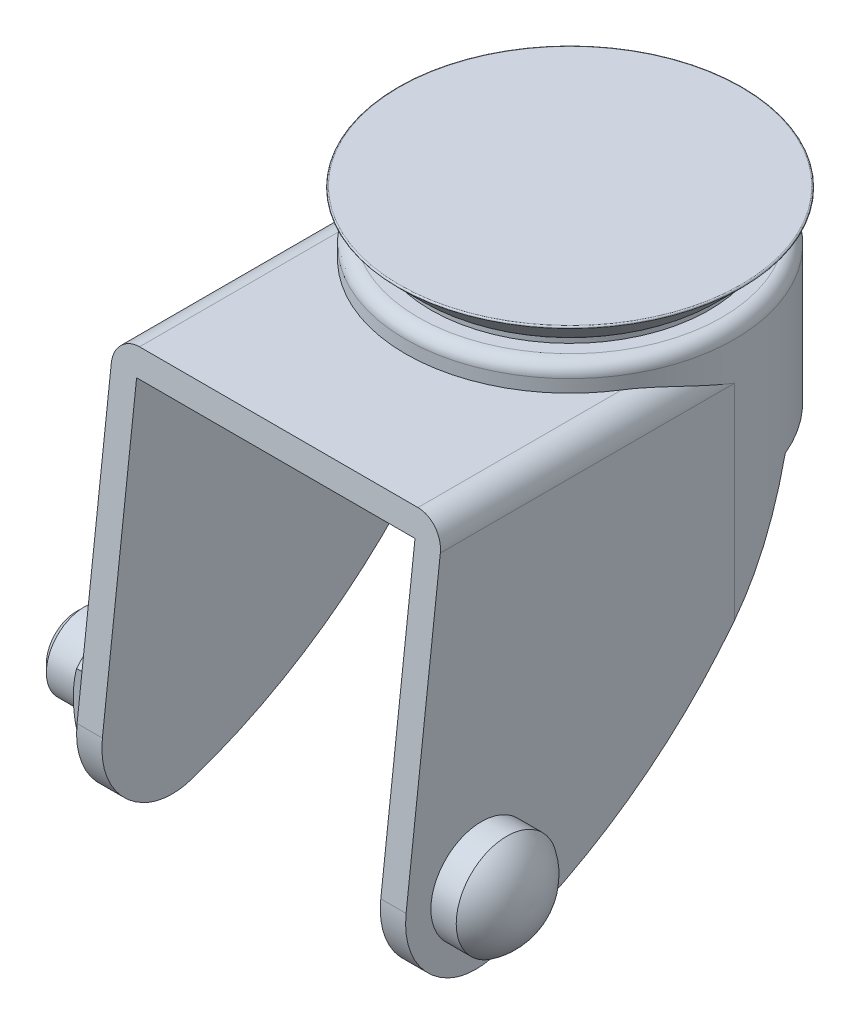
from build123d import *

# Parameters (mm, degrees)
BOSS_EXTRUDE1_DEPTH     = 60
SKETCH3_W               = 22
SKETCH3_H               = 51
CUT_EXTRUDE1_DEPTH      = 70
CUT_EXTRUDE2_START      = -51
SKETCH4_R               = 11
CUT_EXTRUDE2_DEPTH      = 51
CUT_EXTRUDE3_DEPTH      = 200
CUT_EXTRUDE3_DEPTH_BACK = 200
SKETCH8_R               = 5.3
CUT_EXTRUDE4_DEPTH      = 200


with BuildPart() as part:
    # Sketch1 → Revolve1 (revolve)
    with BuildSketch(Plane.XY, mode=Mode.PRIVATE) as revolve1_sk:
        with BuildLine():
            Line((0, 0), (11, 0))
            Line((11, 0), (11, -3))
            Line((11, -3), (12, -3))
            ThreePointArc((12, -3), (12.707106781, -3.292893219), (13, -4))
            Line((13, -4), (13, -51))
            Line((13, -51), (0, -51))
            Line((0, -51), (0, 0))
        make_face()
    revolve(revolve1_sk.sketch.rotate(Axis((0, -51, 0), (0, 1, 0)), 270), axis=Axis((0, -51, 0), (0, 1, 0)))

    # Sketch2 → Boss-Extrude1 (add)
    with BuildSketch(Plane.XY):
        with BuildLine():
            Line((-13, -56), (13, -56))
            Line((13, -56), (13, -7))
            ThreePointArc((13, -7), (12.414213562, -5.585786438), (11, -5))
            Line((11, -5), (-11, -5))
            ThreePointArc((-11, -5), (-12.414213562, -5.585786438), (-13, -7))
            Line((-13, -7), (-13, -56))
        make_face()
    extrude(amount=BOSS_EXTRUDE1_DEPTH)

    # Sketch3 → Cut-Extrude1 (cut)
    with BuildSketch(Plane.XY):
        with Locations((0, -32.5)):
            Rectangle(SKETCH3_W, SKETCH3_H)
    extrude(amount=CUT_EXTRUDE1_DEPTH, mode=Mode.SUBTRACT)

    # Sketch4 → Cut-Extrude2 (cut)
    with BuildSketch(Plane(origin=(0, -4, 0), x_dir=(1, 0, 0), z_dir=(0, 1, 0)).offset(CUT_EXTRUDE2_START)):
        with Locations(Location((0, 0, 0), (0, 0, 270))):
            Circle(SKETCH4_R)
    extrude(amount=CUT_EXTRUDE2_DEPTH, mode=Mode.SUBTRACT)

    # Sketch5 → Cut-Extrude3 (cut, two sides: drawn at the far end of the back side and taken through both)
    with BuildSketch(Plane(origin=(0, 0, 0), x_dir=(0, 0, -1), z_dir=(1, 0, 0)).offset(-CUT_EXTRUDE3_DEPTH_BACK)):
        with BuildLine():
            Line((-150, -4.8), (-150, -300))
            Line((-150, -300), (150, -300))
            Line((150, -300), (150, -14.8))
            Line((150, -14.8), (5, -14.8))
            ThreePointArc((5, -14.8), (-4.621248551, -28.233362883), (-18.851090392, -36.631890327))
            ThreePointArc((-18.851090392, -36.631890327), (-20.797407313, -36.8816693), (-22.689958242, -36.363219617))
            ThreePointArc((-22.689958242, -36.363219617), (-25.279270083, -33.851194029), (-25.960007245, -30.308397776))
            Line((-25.960007245, -30.308397776), (-23, -4.8))
            Line((-23, -4.8), (-150, -4.8))
        make_face()
    extrude(amount=CUT_EXTRUDE3_DEPTH + CUT_EXTRUDE3_DEPTH_BACK, mode=Mode.SUBTRACT)

    # Sketch6 → Revolve2 (revolve)
    with BuildSketch(Plane.XY.offset(20), mode=Mode.PRIVATE) as revolve2_sk:
        with BuildLine():
            Line((13, -31), (13, -27))
            Line((13, -27), (15, -27))
            ThreePointArc((15, -27), (16.53207252, -28.73396374), (17, -31))
            Line((17, -31), (13, -31))
        make_face()
    revolve(revolve2_sk.sketch.rotate(Axis((17, -31, 20), (-1, 0, 0)), 270), axis=Axis((17, -31, 20), (-1, 0, 0)))

    # Sketch7 → Revolve3 (revolve)
    with BuildSketch(Plane.XY.offset(20), mode=Mode.PRIVATE) as revolve3_sk:
        with BuildLine():
            Line((-19, -31), (-19, -28.6135))
            Line((-19, -28.6135), (-18.3865, -28))
            Line((-18.3865, -28), (-16, -28))
            Line((-16, -28), (-16, -28.6))
            ThreePointArc((-16, -28.6), (-15.631562592, -27.345182253), (-15, -26.2))
            Line((-15, -26.2), (-13, -26.2))
            Line((-13, -26.2), (-13, -31))
            Line((-13, -31), (-19, -31))
        make_face()
    revolve(revolve3_sk.sketch.rotate(Axis((-13, -31, 20), (-1, 0, 0)), 270), axis=Axis((-13, -31, 20), (-1, 0, 0)))

    # Sketch8 → Cut-Extrude4 (cut)
    with BuildSketch(Plane(origin=(-13, 0, 0), x_dir=(0, 0, -1), z_dir=(1, 0, 0))):
        with Locations((-20, -31)):
            Circle(SKETCH8_R)
        Polygon((-23.6, -28.921539031), (-23.6, -33.078460969), (-20, -35.156921938), (-16.4, -33.078460969), (-16.4, -28.921539031), (-20, -26.843078062), align=None, mode=Mode.SUBTRACT)
    extrude(amount=-CUT_EXTRUDE4_DEPTH, mode=Mode.SUBTRACT)

    # Sketch9 → Revolve4 (revolve)
    with BuildSketch(Plane.XY, mode=Mode.PRIVATE) as revolve4_sk:
        with BuildLine():
            Line((0, 0), (13.508578644, 0))
            ThreePointArc((13.508578644, 0), (13.600966597, -0.061731657), (13.579289322, -0.170710678))
            Line((13.579289322, -0.170710678), (11.542893219, -2.207106781))
            ThreePointArc((11.542893219, -2.207106781), (11.21846987, -2.423879533), (10.835786438, -2.5))
            Line((10.835786438, -2.5), (0, -2.5))
            Line((0, -2.5), (0, 0))
        make_face()
    revolve(revolve4_sk.sketch.rotate(Axis((0, -2.5, 0), (0, 1, 0)), 270), axis=Axis((0, -2.5, 0), (0, 1, 0)))


solid = part.part
